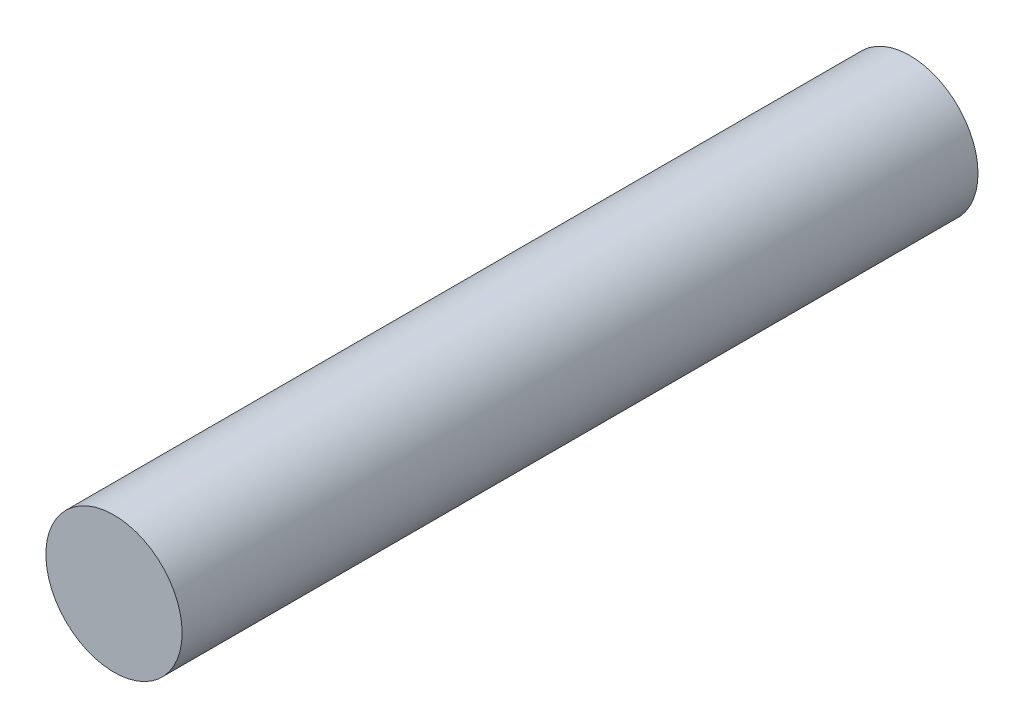
from build123d import *

# Parameters (mm, degrees)
SKETCH2_R           = 1.3589
BOSS_EXTRUDE1_DEPTH = 15.875


with BuildPart() as part:
    # Sketch2 → Boss-Extrude1 (new body)
    with BuildSketch(Plane.XY):
        Circle(SKETCH2_R)
    extrude(amount=BOSS_EXTRUDE1_DEPTH)


solid = part.part
